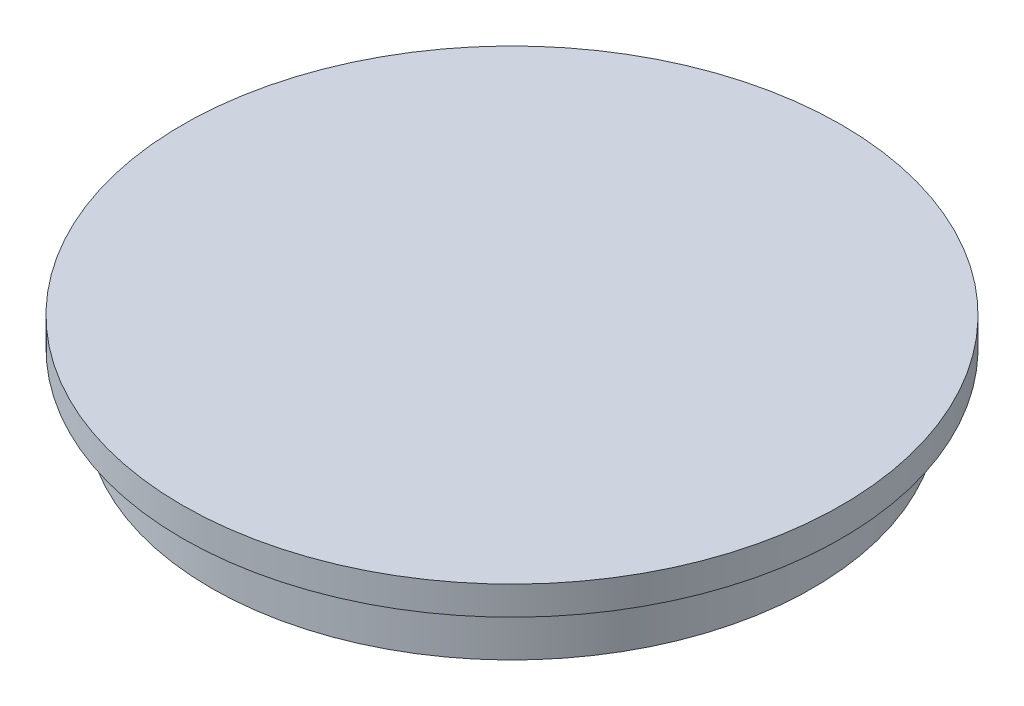
from build123d import *

# Parameters (mm, degrees)
SKETCH1_R           = 29.21
BOSS_EXTRUDE2_DEPTH = 2.54
SKETCH2_R           = 26.67
SKETCH2_R_2         = 22.86
BOSS_EXTRUDE3_DEPTH = 5.08


with BuildPart() as part:
    # Sketch1 → Boss-Extrude2 (new body)
    with BuildSketch(Plane(origin=(0, 0, 0), x_dir=(1, 0, 0), z_dir=(0, 1, 0))):
        with Locations(Location((0, 0, 0), (0, 0, 270))):
            Circle(SKETCH1_R)
    extrude(amount=BOSS_EXTRUDE2_DEPTH)

    # Sketch2 → Boss-Extrude3 (add)
    with BuildSketch(Plane.XZ):
        with Locations(Location((0, 0, 0), (0, 0, 90))):
            Circle(SKETCH2_R)
        with Locations(Location((0, 0, 0), (0, 0, 270))):
            Circle(SKETCH2_R_2, mode=Mode.SUBTRACT)
    extrude(amount=BOSS_EXTRUDE3_DEPTH)


solid = part.part
